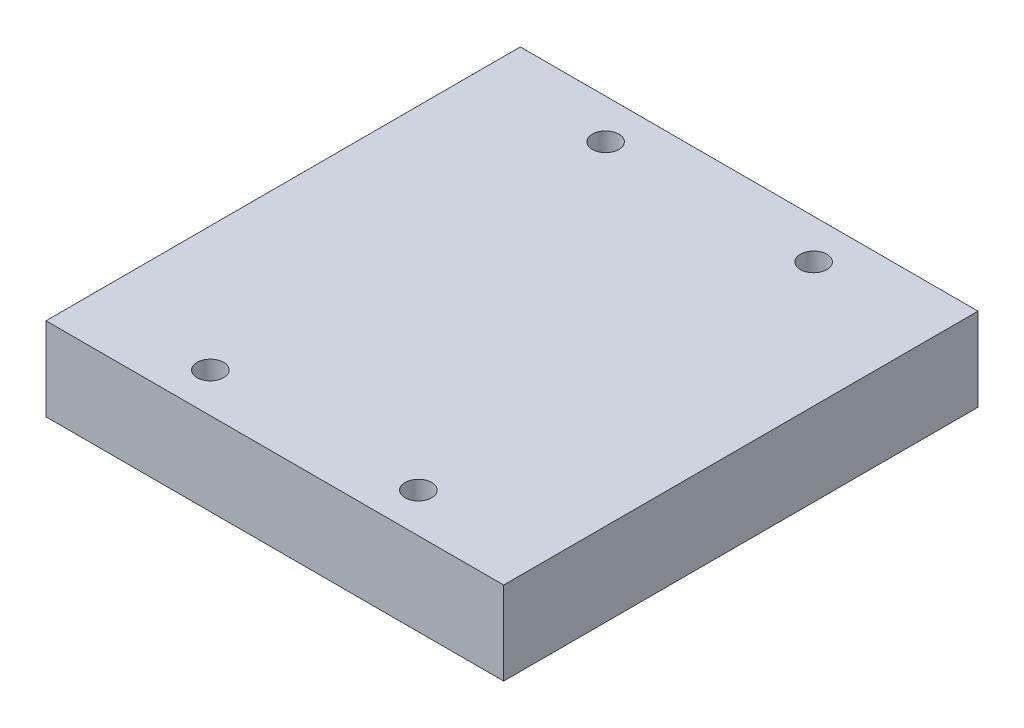
from build123d import *

# Parameters (mm, degrees)
SKETCH1_W           = 55
SKETCH1_H           = 57
BOSS_EXTRUDE1_DEPTH = 10
SKETCH2_R           = 1.6
CUT_EXTRUDE1_DEPTH  = 20


with BuildPart() as part:
    # Sketch1 → Boss-Extrude1 (new body)
    with BuildSketch(Plane(origin=(0, 0, 0), x_dir=(1, 0, 0), z_dir=(0, 1, 0))):
        with Locations((14.332669323, -5.193227092)):
            Rectangle(SKETCH1_W, SKETCH1_H)
    extrude(amount=BOSS_EXTRUDE1_DEPTH)

    # Sketch2 → Cut-Extrude1 (cut)
    with BuildSketch(Plane.XZ):
        with Locations((1.832669323, 28.943227092)):
            Circle(SKETCH2_R)
        with Locations((26.832669323, 28.943227092)):
            Circle(SKETCH2_R)
        with Locations((1.832669323, -18.556772908)):
            Circle(SKETCH2_R)
        with Locations((26.832669323, -18.556772908)):
            Circle(SKETCH2_R)
    extrude(amount=-CUT_EXTRUDE1_DEPTH, mode=Mode.SUBTRACT)


solid = part.part
